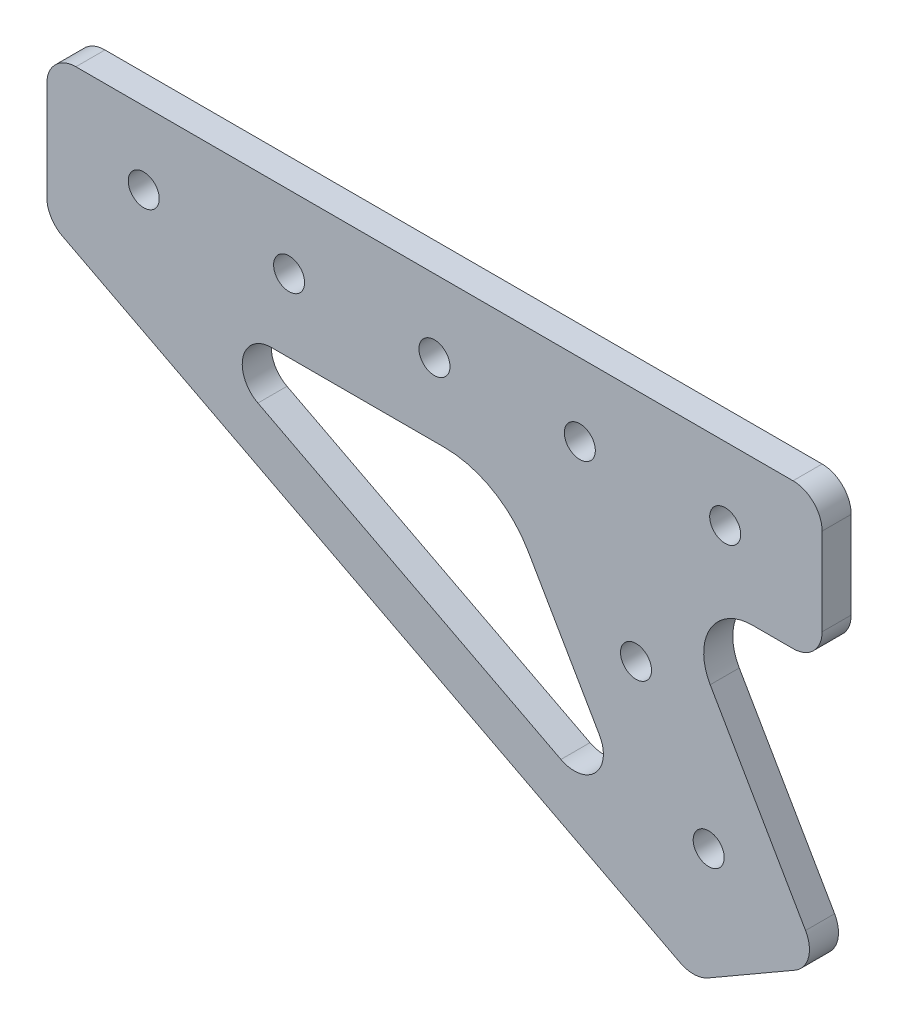
from build123d import *

# Parameters (mm, degrees)
EXTRUDE_1_DEPTH     = 3
FILLET_1_R          = 5
FILLET_2_R          = 10
FILLET_3_R          = 3
SKETCH_2_R          = 1.6
CUT_EXTRUDE_1_DEPTH = 3
FILLET_4_R          = 3


with BuildPart() as part:
    # 草图1 → 凸台-拉伸1 (new body)
    with BuildSketch(Plane.XY):
        Polygon((0, -15), (-15.87797303, -15), (-0.208100049, -42.141016151), (-13.198481106, -49.641016151), (-80, -15), (-80, 0), (0, 0), align=None)
        Polygon((-17.839906221, -41.601832032), (-33.198481106, -15), (-69.138712739, -15), align=None, mode=Mode.SUBTRACT)
    extrude(amount=EXTRUDE_1_DEPTH)

    # 圆角1
    fillet_1_edges = [part.edges().sort_by_distance(p)[0] for p in [
        (-15.87797303, -15, 1.5),
    ]]
    fillet(fillet_1_edges, radius=FILLET_1_R)

    # 圆角2
    fillet_2_edges = [part.edges().sort_by_distance(p)[0] for p in [
        (-33.198481106, -15, 1.5),
    ]]
    fillet(fillet_2_edges, radius=FILLET_2_R)

    # 圆角3
    fillet_3_edges = [part.edges().sort_by_distance(p)[0] for p in [
        (0, -15, 1.5),
        (-0.208100049, -42.141016151, 1.5),
        (-13.198481106, -49.641016151, 1.5),
        (-80, -15, 1.5),
        (-80, 0, 1.5),
        (0, 0, 1.5),
    ]]
    fillet(fillet_3_edges, radius=FILLET_3_R)

    # 草图2 → 切除-拉伸1 (cut)
    with BuildSketch(Plane.XY.offset(3)):
        with Locations((-11.703290577, -37.230762114)):
            Circle(SKETCH_2_R)
        with Locations((-19.203290577, -24.240381057)):
            Circle(SKETCH_2_R)
        with Locations((-10, -7.5)):
            Circle(SKETCH_2_R)
        with Locations((-25, -7.5)):
            Circle(SKETCH_2_R)
        with Locations((-40, -7.5)):
            Circle(SKETCH_2_R)
        with Locations((-55, -7.5)):
            Circle(SKETCH_2_R)
        with Locations((-70, -7.5)):
            Circle(SKETCH_2_R)
    extrude(amount=-CUT_EXTRUDE_1_DEPTH, mode=Mode.SUBTRACT)

    # 圆角4
    fillet_4_edges = [part.edges().sort_by_distance(p)[0] for p in [
        (-69.138712739, -15, 1.5),
        (-17.839906221, -41.601832032, 1.5),
    ]]
    fillet(fillet_4_edges, radius=FILLET_4_R)


solid = part.part
